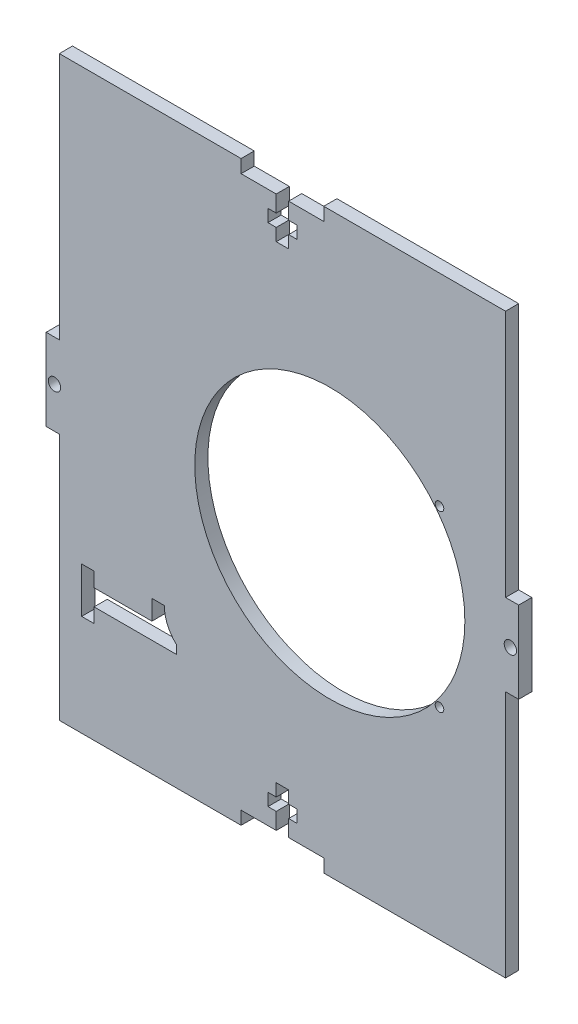
from build123d import *

# Parameters (mm, degrees)
SKETCH1_W           = 114.3
SKETCH1_H           = 139.7
BOSS_EXTRUDE1_DEPTH = 3.18
SKETCH2_R           = 1.5
SKETCH2_W           = 3.18
SKETCH2_H           = 59.975
CUT_EXTRUDE1_DEPTH  = 91.306463778
CUT_EXTRUDE5_DEPTH  = 12
SKETCH5_R           = 32.671394307
CUT_EXTRUDE6_DEPTH  = 10
SKETCH9_R           = 1.042012373
CUT_EXTRUDE8_DEPTH  = 91.306463778


with BuildPart() as part:
    # Sketch1 → Boss-Extrude1 (new body)
    with BuildSketch(Plane.XY):
        Rectangle(SKETCH1_W, SKETCH1_H)
    extrude(amount=BOSS_EXTRUDE1_DEPTH)

    # Sketch2 → Cut-Extrude1 (cut, through all)
    with BuildSketch(Plane.XY.offset(3.18)):
        with Locations((-55.15, 0)):
            Circle(SKETCH2_R)
        with Locations((55.15, 0)):
            Circle(SKETCH2_R)
        Polygon((-10, 69.85), (10, 69.85), (10, 66.67), (1.5, 66.67), (1.5, 62.67), (3.5, 62.67), (3.5, 59.67), (1.5, 59.67), (1.5, 56.67), (-1.5, 56.67), (-1.5, 59.67), (-3.5, 59.67), (-3.5, 62.67), (-1.5, 62.67), (-1.5, 66.67), (-10, 66.67), align=None)
        Polygon((-10, -69.85), (-10, -66.67), (-1.5, -66.67), (-1.5, -62.67), (-3.5, -62.67), (-3.5, -59.67), (-1.5, -59.67), (-1.5, -56.67), (1.5, -56.67), (1.5, -59.67), (3.5, -59.67), (3.5, -62.67), (1.5, -62.67), (1.5, -66.67), (10, -66.67), (10, -69.85), align=None)
        with Locations((-55.56, 39.8625)):
            Rectangle(SKETCH2_W, SKETCH2_H)
        with Locations((-55.56, -39.8625)):
            Rectangle(SKETCH2_W, SKETCH2_H)
        with Locations((55.56, -39.8625)):
            Rectangle(SKETCH2_W, SKETCH2_H)
        with Locations((55.56, 39.8625)):
            Rectangle(SKETCH2_W, SKETCH2_H)
    extrude(amount=-CUT_EXTRUDE1_DEPTH, mode=Mode.SUBTRACT)

    # Sketch4 → Cut-Extrude5 (cut)
    with BuildSketch(Plane.XY):
        with BuildLine():
            Line((-25.57107609, -41.8625), (-45.57107609, -41.8625))
            Line((-45.57107609, -41.8625), (-45.57107609, -45.3625))
            Line((-45.57107609, -45.3625), (-48.57107609, -45.3625))
            Line((-48.57107609, -45.3625), (-48.57107609, -34.3625))
            Line((-48.57107609, -34.3625), (-45.57107609, -34.3625))
            Line((-45.57107609, -34.3625), (-45.57107609, -37.8625))
            Line((-45.57107609, -37.8625), (-31.57107609, -37.8625))
            Line((-31.57107609, -37.8625), (-31.57107609, -33.087601989))
            Line((-31.57107609, -33.087601989), (-28.57107609, -33.087601989))
            ThreePointArc((-28.57107609, -33.087601989), (-27.787526444, -36.79230316), (-25.57107609, -39.8625))
            Line((-25.57107609, -39.8625), (-25.57107609, -41.8625))
        make_face()
    extrude(amount=CUT_EXTRUDE5_DEPTH, mode=Mode.SUBTRACT)

    # Sketch5 → Cut-Extrude6 (cut)
    with BuildSketch(Plane.XY.offset(3.18)):
        with Locations((11.462576996, 0)):
            Circle(SKETCH5_R)
    extrude(amount=-CUT_EXTRUDE6_DEPTH, mode=Mode.SUBTRACT)

    # Sketch9 → Cut-Extrude8 (cut, through all)
    with BuildSketch(Plane.XY.offset(3.18)):
        with Locations((37.991387583, -21.1)):
            Circle(SKETCH9_R)
        with Locations((37.991387583, 21.008299604)):
            Circle(SKETCH9_R)
    extrude(amount=-CUT_EXTRUDE8_DEPTH, mode=Mode.SUBTRACT)


solid = part.part
